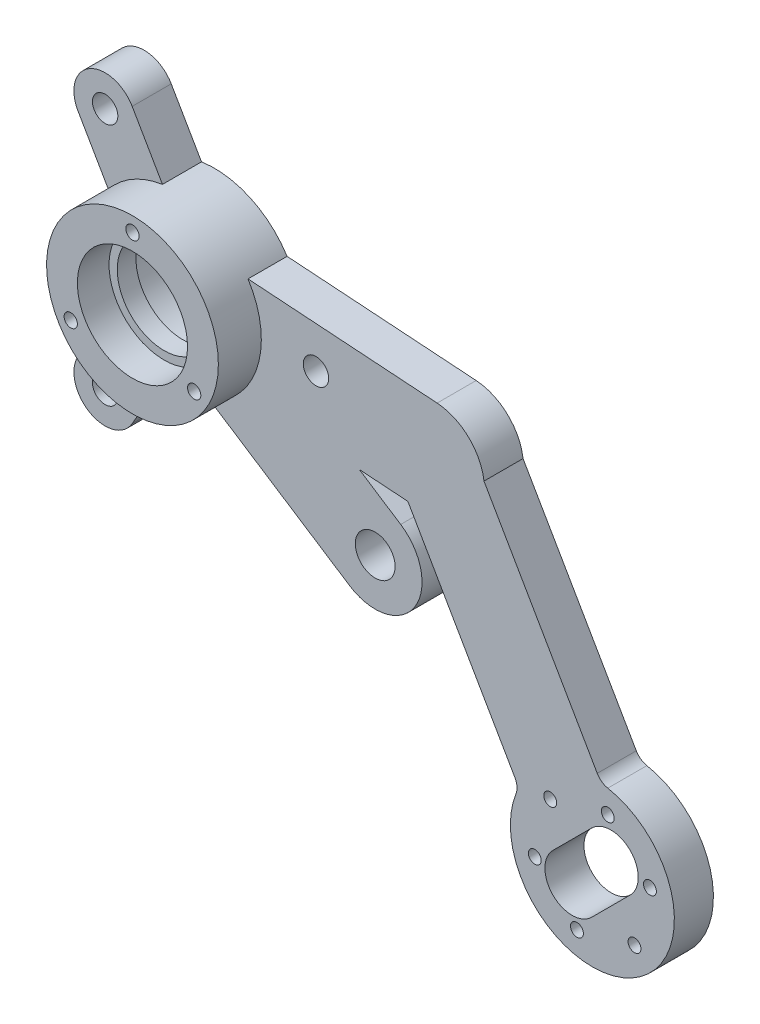
from build123d import *

# Parameters (mm, degrees)
S01_BEARING_BARREL_R                             = 22
F_01_BEARING_BARREL_DEPTH                        = 21
F_02_TORQUE_ARM_1_DEPTH                          = 10
F_03_TORQUE_ARM_2_DEPTH                          = 10
F_04_TORQUE_ARM_3_DEPTH                          = 10
F_05_WHEEL_ARM_ROOT_TO_ROUNDED_ELBOW_DEPTH       = 10
F_06_LONG_DROPPED_WHEEL_ARM_DEPTH                = 10
F_07_BROAD_CAM_FOLLOWER_MOUNTING_LUG_DEPTH       = 10
F_08_START                                       = -1
S08_BEARING_THROUGH_RELIEF_R                     = 12
F_08_BEARING_THROUGH_RELIEF_DEPTH                = 23
F_09_START                                       = -0.1
S09_INBOARD_6001_SEAT_R                          = 14.1
F_09_INBOARD_6001_SEAT_DEPTH                     = 8.2
F_10_START                                       = 12.9
S10_OUTBOARD_6001_SEAT_R                         = 14.1
F_10_OUTBOARD_6001_SEAT_DEPTH                    = 8.2
F_11_START                                       = -1
S11_KEEPER_SCREWS_R                              = 1.7
F_11_KEEPER_SCREWS_DEPTH                         = 23
F_12_START                                       = -1
S12_TORQUE_PIN_RETAINING_STEMS_R                 = 3.25
F_12_TORQUE_PIN_RETAINING_STEMS_DEPTH            = 12
F_19_START                                       = -1
S19_THROUGH_BORE_FOR_STEEL_FOLLOWER_BU_R         = 5.1
F_19_THROUGH_BORE_FOR_STEEL_FOLLOWER_BUS_DEPTH   = 12
F_20_START                                       = -0.1
S20_FLUSH_SEAT_FOR_BUSH_FLANGE_R                 = 7.6
F_20_FLUSH_SEAT_FOR_BUSH_FLANGE_DEPTH            = 2.1
FLAT_MOTOR_MOUNTING_PAD_LAYOUT_R                 = 21
FLAT_MOTOR_MOUNTING_PAD_DEPTH                    = 10
R4_BLENDS_FROM_ARM_INTO_MOTOR_PAD_R              = 4
F_28_START                                       = 10.12
F_28_X_14_CLOSED_THROUGH_SLOT_FOR_MOTOR_OU_DEPTH = 10.24
SIX_START                                        = 10.12
SIX_CLEARANCE_HOLES_FROM_JOHNSON_MOT_2_R         = 1.65
SIX_CLEARANCE_HOLES_FROM_JOHNSON_MOTOR_F_DEPTH   = 10.24


with BuildPart() as part:
    # S01 - Bearing barrel → 01 - Bearing barrel (new body)
    with BuildSketch(Plane.XY):
        Circle(S01_BEARING_BARREL_R)
    extrude(amount=F_01_BEARING_BARREL_DEPTH)

    # S02 - Torque arm 1 → 02 - Torque arm 1 (add)
    with BuildSketch(Plane.XY):
        with BuildLine():
            Line((0, 8), (36, 8))
            ThreePointArc((36, 8), (44, 0), (36, -8))
            Line((36, -8), (0, -8))
            ThreePointArc((0, -8), (-8, 0), (0, 8))
        make_face()
    extrude(amount=F_02_TORQUE_ARM_1_DEPTH)

    # S03 - Torque arm 2 → 03 - Torque arm 2 (add)
    with BuildSketch(Plane.XY):
        with BuildLine():
            Line((-6.92820323, -4), (-24.92820323, 27.176914536))
            ThreePointArc((-24.92820323, 27.176914536), (-22, 38.105117767), (-11.07179677, 35.176914536))
            Line((-11.07179677, 35.176914536), (6.92820323, 4))
            ThreePointArc((6.92820323, 4), (4, -6.92820323), (-6.92820323, -4))
        make_face()
    extrude(amount=F_03_TORQUE_ARM_2_DEPTH)

    # S04 - Torque arm 3 → 04 - Torque arm 3 (add)
    with BuildSketch(Plane.XY):
        with BuildLine():
            Line((6.92820323, -4), (-11.07179677, -35.176914536))
            ThreePointArc((-11.07179677, -35.176914536), (-22, -38.105117767), (-24.92820323, -27.176914536))
            Line((-24.92820323, -27.176914536), (-6.92820323, 4))
            ThreePointArc((-6.92820323, 4), (4, 6.92820323), (6.92820323, -4))
        make_face()
    extrude(amount=F_04_TORQUE_ARM_3_DEPTH)

    # S05 - Wheel arm root to rounded elbow → 05 - Wheel arm root to rounded elbow (add)
    with BuildSketch(Plane.XY):
        with BuildLine():
            Line((0.890943823, 12.969434032), (67.022341031, 8.426494092))
            ThreePointArc((67.022341031, 8.426494092), (79.10083124, -5.433883763), (65.240453385, -17.512373972))
            Line((65.240453385, -17.512373972), (-0.890943823, -12.969434032))
            ThreePointArc((-0.890943823, -12.969434032), (-12.969434032, 0.890943823), (0.890943823, 12.969434032))
        make_face()
    extrude(amount=F_05_WHEEL_ARM_ROOT_TO_ROUNDED_ELBOW_DEPTH)

    # S06 - Long dropped wheel arm → 06 - Long dropped wheel arm (add)
    with BuildSketch(Plane.XY):
        with BuildLine():
            Line((76.528125799, 1.449391376), (116.886494349, -68.572605409))
            ThreePointArc((116.886494349, -68.572605409), (112.482097074, -84.961665317), (96.093037167, -80.557268042))
            Line((96.093037167, -80.557268042), (55.734668617, -10.535271257))
            ThreePointArc((55.734668617, -10.535271257), (60.139065892, 5.853788651), (76.528125799, 1.449391376))
        make_face()
    extrude(amount=F_06_LONG_DROPPED_WHEEL_ARM_DEPTH)

    # S07 - Broad cam follower mounting lug → 07 - Broad cam follower mounting lug (add)
    with BuildSketch(Plane.XY):
        with BuildLine():
            Line((6.53566842, 10.064046815), (57.694573065, -23.158934321))
            ThreePointArc((57.694573065, -23.158934321), (61.22295146, -39.758649556), (44.623236224, -43.287027951))
            Line((44.623236224, -43.287027951), (-6.53566842, -10.064046815))
            ThreePointArc((-6.53566842, -10.064046815), (-10.064046815, 6.53566842), (6.53566842, 10.064046815))
        make_face()
    extrude(amount=F_07_BROAD_CAM_FOLLOWER_MOUNTING_LUG_DEPTH)

    # S08 - Bearing through relief → 08 - Bearing through relief (cut)
    with BuildSketch(Plane.XY.offset(F_08_START)):
        Circle(S08_BEARING_THROUGH_RELIEF_R)
    extrude(amount=F_08_BEARING_THROUGH_RELIEF_DEPTH, mode=Mode.SUBTRACT)

    # S09 - Inboard 6001 seat → 09 - Inboard 6001 seat (cut)
    with BuildSketch(Plane.XY.offset(F_09_START)):
        Circle(S09_INBOARD_6001_SEAT_R)
    extrude(amount=F_09_INBOARD_6001_SEAT_DEPTH, mode=Mode.SUBTRACT)

    # S10 - Outboard 6001 seat → 10 - Outboard 6001 seat (cut)
    with BuildSketch(Plane.XY.offset(F_10_START)):
        Circle(S10_OUTBOARD_6001_SEAT_R)
    extrude(amount=F_10_OUTBOARD_6001_SEAT_DEPTH, mode=Mode.SUBTRACT)

    # S11 - Keeper screws → 11 - Keeper screws (cut)
    with BuildSketch(Plane.XY.offset(F_11_START)):
        with Locations((0, 18.25)):
            Circle(S11_KEEPER_SCREWS_R)
        with Locations((-15.804963619, -9.125)):
            Circle(S11_KEEPER_SCREWS_R)
        with Locations((15.804963619, -9.125)):
            Circle(S11_KEEPER_SCREWS_R)
    extrude(amount=F_11_KEEPER_SCREWS_DEPTH, mode=Mode.SUBTRACT)

    # S12 - Torque pin retaining stems → 12 - Torque pin retaining stems (cut)
    with BuildSketch(Plane.XY.offset(F_12_START)):
        with Locations((36, 0)):
            Circle(S12_TORQUE_PIN_RETAINING_STEMS_R)
        with Locations((-18, 31.176914536)):
            Circle(S12_TORQUE_PIN_RETAINING_STEMS_R)
        with Locations((-18, -31.176914536)):
            Circle(S12_TORQUE_PIN_RETAINING_STEMS_R)
    extrude(amount=F_12_TORQUE_PIN_RETAINING_STEMS_DEPTH, mode=Mode.SUBTRACT)

    # S19 - Through bore for steel follower bush → 19 - Through bore for steel follower bush (cut)
    with BuildSketch(Plane.XY.offset(F_19_START)):
        with Locations((51.158904645, -33.222981136)):
            Circle(S19_THROUGH_BORE_FOR_STEEL_FOLLOWER_BU_R)
    extrude(amount=F_19_THROUGH_BORE_FOR_STEEL_FOLLOWER_BUS_DEPTH, mode=Mode.SUBTRACT)

    # S20 - Flush seat for bush flange → 20 - Flush seat for bush flange (cut)
    with BuildSketch(Plane.XY.offset(F_20_START)):
        with Locations((51.158904645, -33.222981136)):
            Circle(S20_FLUSH_SEAT_FOR_BUSH_FLANGE_R)
    extrude(amount=F_20_FLUSH_SEAT_FOR_BUSH_FLANGE_DEPTH, mode=Mode.SUBTRACT)

    # Flat motor mounting pad layout → Flat motor mounting pad (add)
    with BuildSketch(Plane.XY):
        with Locations((106.780015642, -75.748703358)):
            Circle(FLAT_MOTOR_MOUNTING_PAD_LAYOUT_R)
    extrude(amount=FLAT_MOTOR_MOUNTING_PAD_DEPTH)

    # R4 blends from arm into motor pad
    r4_blends_from_arm_into_motor_pad_edges = [part.edges().sort_by_distance(p)[0] for p in [
        (87.956079001, -66.439599786, 5),
        (108.985808176, -54.864870393, 5),
    ]]
    fillet(r4_blends_from_arm_into_motor_pad_edges, radius=R4_BLENDS_FROM_ARM_INTO_MOTOR_PAD_R)

    # Original round-ended output slot layout → 28 x 14 closed through slot for motor output (cut)
    with BuildSketch(Plane.XY.offset(F_28_START)):
        with BuildLine():
            Line((96.668388671, -75.960835392), (106.567883608, -66.061340455))
            ThreePointArc((106.567883608, -66.061340455), (116.467378544, -66.061340455), (116.467378544, -75.960835392))
            Line((116.467378544, -75.960835392), (106.567883608, -85.860330328))
            ThreePointArc((106.567883608, -85.860330328), (96.668388671, -85.860330328), (96.668388671, -75.960835392))
        make_face()
    extrude(amount=-F_28_X_14_CLOSED_THROUGH_SLOT_FOR_MOTOR_OU_DEPTH, mode=Mode.SUBTRACT)

    # Six clearance holes from Johnson mot 2 → Six clearance holes from Johnson motor f (cut)
    with BuildSketch(Plane.XY.offset(SIX_START)):
        with Locations((92.035157904, -79.699576081)):
            Circle(SIX_CLEARANCE_HOLES_FROM_JOHNSON_MOT_2_R)
        with Locations((102.829142919, -90.493561096)):
            Circle(SIX_CLEARANCE_HOLES_FROM_JOHNSON_MOT_2_R)
        with Locations((117.574000657, -86.542688372)):
            Circle(SIX_CLEARANCE_HOLES_FROM_JOHNSON_MOT_2_R)
        with Locations((121.52487338, -71.797830634)):
            Circle(SIX_CLEARANCE_HOLES_FROM_JOHNSON_MOT_2_R)
        with Locations((110.730888366, -61.003845619)):
            Circle(SIX_CLEARANCE_HOLES_FROM_JOHNSON_MOT_2_R)
        with Locations((95.986030627, -64.954718343)):
            Circle(SIX_CLEARANCE_HOLES_FROM_JOHNSON_MOT_2_R)
    extrude(amount=-SIX_CLEARANCE_HOLES_FROM_JOHNSON_MOTOR_F_DEPTH, mode=Mode.SUBTRACT)


solid = part.part
